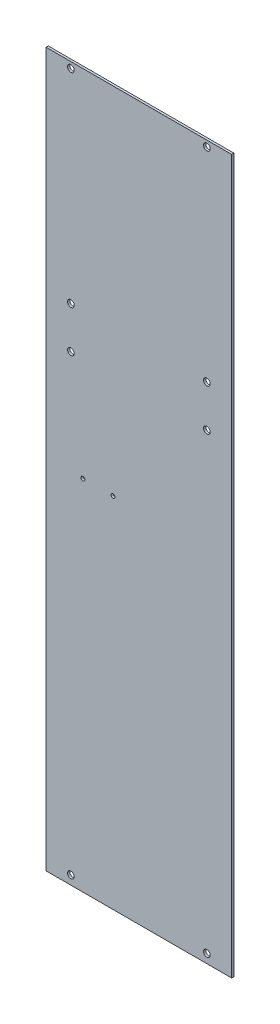
from build123d import *

# Parameters (mm, degrees)
SKETCH1_W                    = 83.2
SKETCH1_H                    = 320
BOSS_EXTRUDE1_DEPTH          = 1
F_3_0_3_DIAMETER_HOLE1_D     = 3
F_1_75_1_75_DIAMETER_HOLE1_D = 1.75


with BuildPart() as part:
    # Sketch1 → Boss-Extrude1 (new body)
    with BuildSketch(Plane.XY):
        Rectangle(SKETCH1_W, SKETCH1_H)
    extrude(amount=BOSS_EXTRUDE1_DEPTH)

    # Ø3.0 (3) Diameter Hole1 (through all)
    with Locations(Plane.XY.offset(1)):
        with Locations((-30.5, 66), (30.5, 66), (30.5, -156), (-30.5, -156), (-30.5, 157.3), (30.5, 157.3), (-30.5, 47.3), (30.5, 47.3)):
            Hole(F_3_0_3_DIAMETER_HOLE1_D / 2)

    # Ø1.75 (1.75) Diameter Hole1 (through all)
    with Locations(Plane.XY.offset(1)):
        with Locations((-25.099975914, 0.65), (-11.599975914, 0.65)):
            Hole(F_1_75_1_75_DIAMETER_HOLE1_D / 2)


solid = part.part
